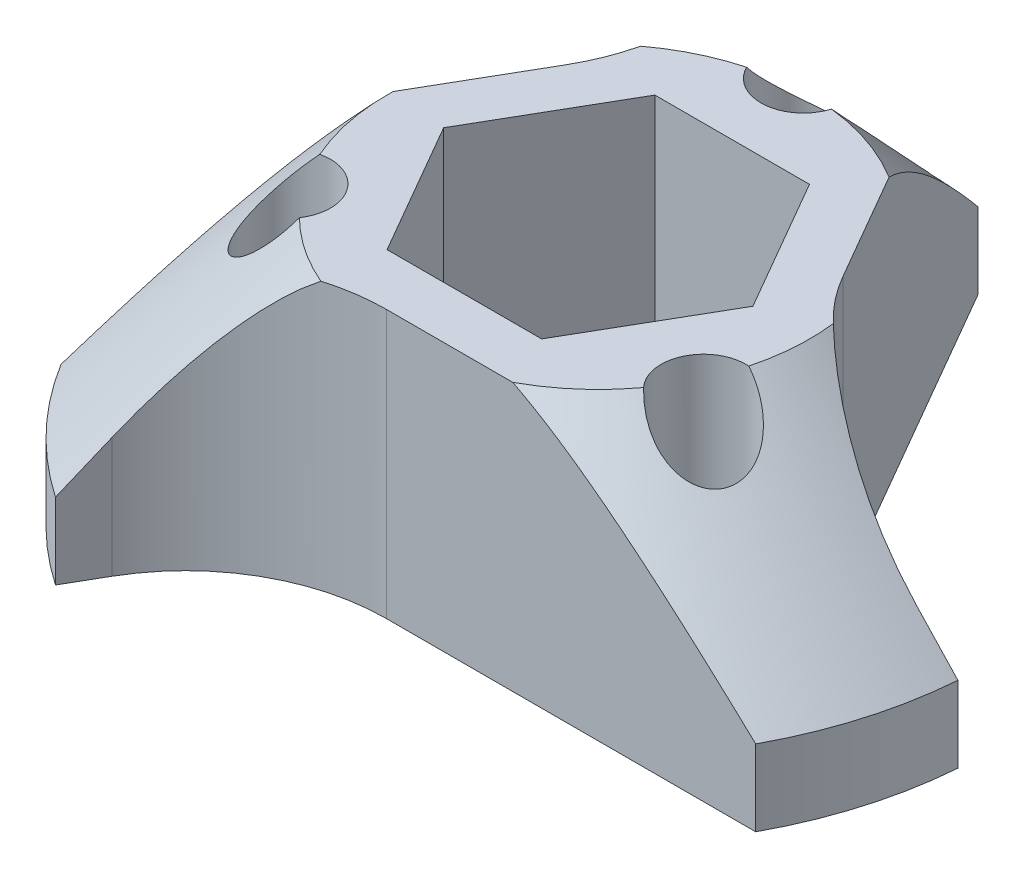
from build123d import *

# Parameters (mm, degrees)
SKETCH1_R           = 1.9
BOSS_EXTRUDE1_DEPTH = 12
CIRPATTERN1_COUNT   = 3
CUT_EXTRUDE1_DEPTH  = 9
SKETCH4_R           = 1.9
CUT_EXTRUDE2_DEPTH  = 12
CIRPATTERN2_COUNT   = 3


with BuildPart() as part:
    # Sketch1 → Boss-Extrude1 (new body)
    with BuildSketch(Plane(origin=(0, 0, 0), x_dir=(1, 0, 0), z_dir=(0, 1, 0))):
        with BuildLine():
            ThreePointArc((-0.477365515, 17.493487993), (-4.114019559, 17.009551525), (-7.569865672, 15.778058617))
            Line((-7.569865672, 15.778058617), (-6.639528096, 14.166666667))
            ThreePointArc((-6.639528096, 14.166666667), (-5.43375673, 9.666666667), (-6.639528096, 5.166666667))
            Line((-6.639528096, 5.166666667), (-14.43375673, -8.333333333))
            Line((-14.43375673, -8.333333333), (14.43375673, -8.333333333))
            Line((14.43375673, -8.333333333), (-0.477365515, 17.493487993))
        make_face()
        with Locations(Location((0, 0, 0), (0, 0, 270))):
            Circle(SKETCH1_R, mode=Mode.SUBTRACT)
    boss_extrude1 = extrude(amount=BOSS_EXTRUDE1_DEPTH)

    # CirPattern1: Boss-Extrude1 ×3 about axis
    cirpattern1_axis = Axis((0, 0, 0), (0, 1, 0))
    for i in range(1, CIRPATTERN1_COUNT):
        add(boss_extrude1.rotate(cirpattern1_axis, i * 360 / CIRPATTERN1_COUNT))

    # Sketch3 → Cut-Extrude1 (cut)
    with BuildSketch(Plane(origin=(0, 12, 0), x_dir=(1, 0, 0), z_dir=(0, 1, 0))):
        Polygon((3.464101615, 6), (-3.464101615, 6), (-6.92820323, 0), (-3.464101615, -6), (3.464101615, -6), (6.92820323, 0), align=None)
    extrude(amount=-CUT_EXTRUDE1_DEPTH, mode=Mode.SUBTRACT)

    # Sketch4 → Cut-Extrude2 (cut)
    with BuildSketch(Plane(origin=(0, 12, 0), x_dir=(1, 0, 0), z_dir=(0, 1, 0))):
        with Locations(Location((-0.780031957, 9.96953109, 0), (0, 0, 270))):
            Circle(SKETCH4_R)
    cut_extrude2 = extrude(amount=-CUT_EXTRUDE2_DEPTH, mode=Mode.SUBTRACT)

    # CirPattern2: Cut-Extrude2 ×3 about axis
    cirpattern2_axis = Axis((0, 0, 0), (0, 1, 0))
    for i in range(1, CIRPATTERN2_COUNT):
        add(cut_extrude2.rotate(cirpattern2_axis, i * 360 / CIRPATTERN2_COUNT), mode=Mode.SUBTRACT)

    # Sketch5 → Cut-Revolve2 (revolve, cut)
    with BuildSketch(Plane.XY):
        Polygon((17.884587384, 3), (9.470286093, 12), (17.884587384, 12), align=None)
    revolve(axis=Axis((0, 0, 0), (0, 1, 0)), mode=Mode.SUBTRACT)


solid = part.part
